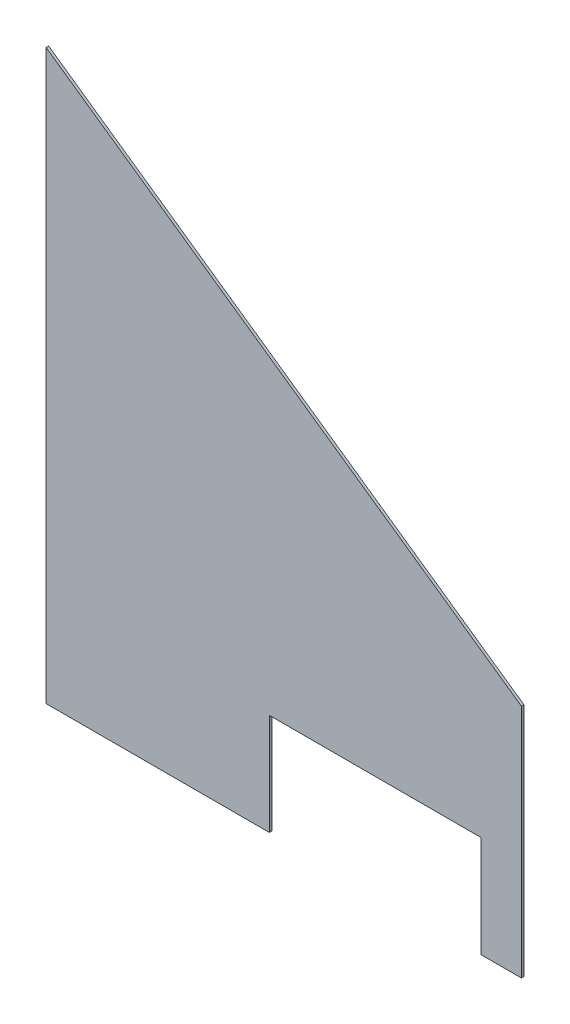
from build123d import *

# Parameters (mm, degrees)
BOSS_EXTRUDE1_DEPTH = 3.175


with BuildPart() as part:
    # Sketch1 → Boss-Extrude1 (new body)
    with BuildSketch(Plane.XY):
        Polygon((-32.915696386, -20.583175965), (246.484303614, -20.583175965), (246.484303614, 106.416824035), (511.152303614, 106.416824035), (511.152303614, -20.583175965), (561.952303614, -20.583175965), (561.952303614, 274.085766196), (473.230737732, 336.209275428), (-32.915696386, 690.616824035), align=None)
    extrude(amount=BOSS_EXTRUDE1_DEPTH)


solid = part.part
